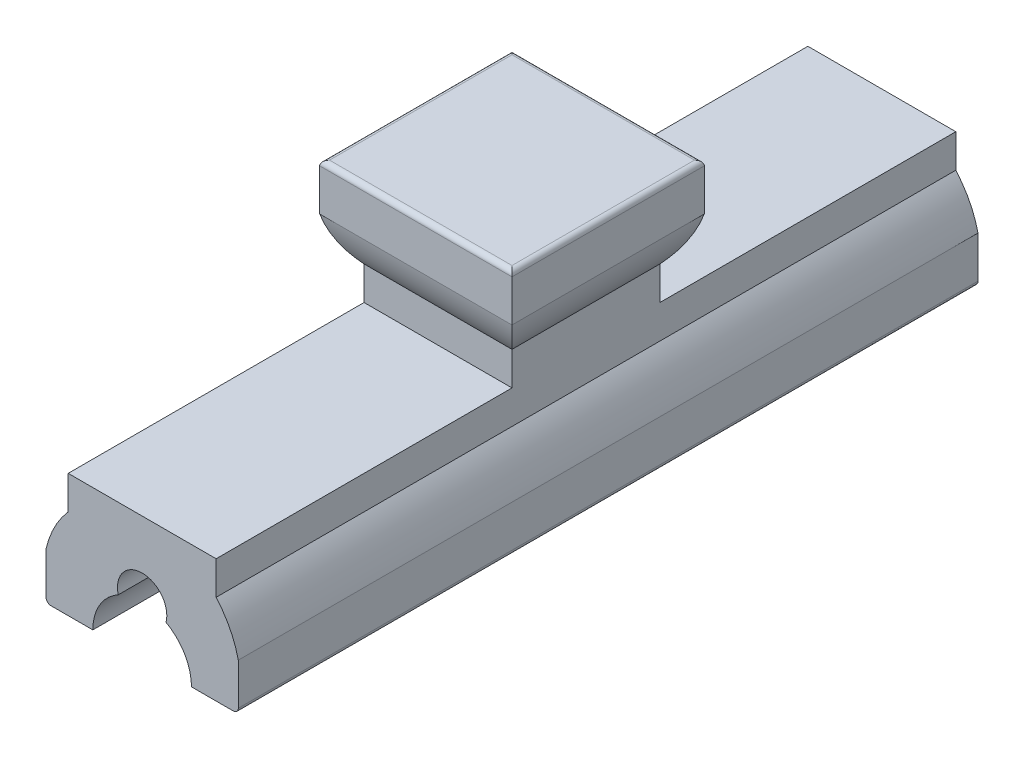
from build123d import *

# Parameters (mm, degrees)
EXTRUDE_2_DEPTH                 = 7.5
EXTRUDE_2_DEPTH_BACK            = 7.5
SKETCH_3_W                      = 3
SKETCH_3_H                      = 3
EXTRUDE_3_DEPTH                 = 1
EXTRUDE_4_DEPTH                 = 2
EXTRUDE_4_DEPTH_BACK            = 2
CUT_EXTRUDE_1_REACH             = 10.143
CUT_EXTRUDE_1_DIRECTION_2_REACH = 10.143
FILLET_1_R                      = 0.1


with BuildPart() as part:
    # 草图2 → 凸台-拉伸2 (new, two sides: drawn at the far end of the back side and taken through both)
    with BuildSketch(Plane.XY.offset(-EXTRUDE_2_DEPTH_BACK)):
        with BuildLine():
            Line((-1.95, -2.5), (-1, -2.5))
            ThreePointArc((-1, -2.5), (-0.861429892, -1.992123498), (-0.484122918, -1.625))
            ThreePointArc((-0.484122918, -1.625), (0, -1), (0.484122918, -1.625))
            ThreePointArc((0.484122918, -1.625), (0.861429892, -1.992123498), (1, -2.5))
            Line((1, -2.5), (1.95, -2.5))
            Line((1.95, -2.5), (1.95, -1.555590279))
            ThreePointArc((1.95, -1.555590279), (1.780042303, -1.088161527), (1.5, -0.677124344))
            Line((1.5, -0.677124344), (1.5, 0))
            Line((1.5, 0), (-1.5, 0))
            Line((-1.5, 0), (-1.5, -0.677124344))
            ThreePointArc((-1.5, -0.677124344), (-1.780042303, -1.088161527), (-1.95, -1.555590279))
            Line((-1.95, -1.555590279), (-1.95, -2.5))
        make_face()
    extrude(amount=EXTRUDE_2_DEPTH + EXTRUDE_2_DEPTH_BACK)

    # 草图3 → 凸台-拉伸3 (add)
    with BuildSketch(Plane(origin=(0, 0, 0), x_dir=(-1, 0, 0), z_dir=(0, 1, 0))):
        Rectangle(SKETCH_3_W, SKETCH_3_H)
    extrude(amount=EXTRUDE_3_DEPTH)

    # 草图4 → 凸台-拉伸4 (add, two sides: drawn at the far end of the back side and taken through both)
    with BuildSketch(Plane.XY.offset(-EXTRUDE_4_DEPTH_BACK)):
        with BuildLine():
            Line((1.95, 2.5), (-1.95, 2.5))
            Line((-1.95, 2.5), (-1.95, 1.555590279))
            ThreePointArc((-1.95, 1.555590279), (-1.780042303, 1.088161527), (-1.5, 0.677124344))
            Line((-1.5, 0.677124344), (1.5, 0.677124344))
            ThreePointArc((1.5, 0.677124344), (1.780042303, 1.088161527), (1.95, 1.555590279))
            Line((1.95, 1.555590279), (1.95, 2.5))
        make_face()
    extrude(amount=EXTRUDE_4_DEPTH + EXTRUDE_4_DEPTH_BACK)

    # 草图5 → 切除-拉伸1 (cut, up to next)
    with BuildSketch(Plane(origin=(0, 0, 0), x_dir=(0, 0, -1), z_dir=(1, 0, 0)), mode=Mode.PRIVATE) as cut_extrude_1_sk1:
        with BuildLine():
            Line((1.95, 2.5), (2, 2.5))
            Line((2, 2.5), (2, 0.677124344))
            Line((2, 0.677124344), (1.5, 0.677124344))
            ThreePointArc((1.5, 0.677124344), (1.780042303, 1.088161527), (1.95, 1.555590279))
            Line((1.95, 1.555590279), (1.95, 2.5))
        make_face()
    cut_extrude_1_tool1 = extrude(cut_extrude_1_sk1.sketch, amount=-CUT_EXTRUDE_1_REACH, mode=Mode.PRIVATE) & part.part
    # 草图5 → 切除-拉伸1 (cut, up to next)
    with BuildSketch(Plane(origin=(0, 0, 0), x_dir=(0, 0, -1), z_dir=(1, 0, 0)), mode=Mode.PRIVATE) as cut_extrude_1_sk2:
        with BuildLine():
            Line((-1.95, 2.5), (-1.95, 1.555590279))
            ThreePointArc((-1.95, 1.555590279), (-1.780042303, 1.088161527), (-1.5, 0.677124344))
            Line((-1.5, 0.677124344), (-2, 0.677124344))
            Line((-2, 0.677124344), (-2, 2.5))
            Line((-2, 2.5), (-1.95, 2.5))
        make_face()
    cut_extrude_1_tool2 = extrude(cut_extrude_1_sk2.sketch, amount=-CUT_EXTRUDE_1_REACH, mode=Mode.PRIVATE) & part.part
    add(cut_extrude_1_tool1.solids().sort_by_distance((0, 1.175075, -1.873038))[0], mode=Mode.SUBTRACT)
    add(cut_extrude_1_tool2.solids().sort_by_distance((0, 1.175075, 1.873038))[0], mode=Mode.SUBTRACT)

    # 草图5 → 切除-拉伸1 direction 2 (cut, up to next)
    with BuildSketch(Plane(origin=(0, 0, 0), x_dir=(0, 0, -1), z_dir=(1, 0, 0)), mode=Mode.PRIVATE) as cut_extrude_1_direction_2_sk1:
        with BuildLine():
            Line((1.95, 2.5), (2, 2.5))
            Line((2, 2.5), (2, 0.677124344))
            Line((2, 0.677124344), (1.5, 0.677124344))
            ThreePointArc((1.5, 0.677124344), (1.780042303, 1.088161527), (1.95, 1.555590279))
            Line((1.95, 1.555590279), (1.95, 2.5))
        make_face()
    cut_extrude_1_direction_2_tool1 = extrude(cut_extrude_1_direction_2_sk1.sketch, amount=CUT_EXTRUDE_1_DIRECTION_2_REACH, mode=Mode.PRIVATE) & part.part
    # 草图5 → 切除-拉伸1 direction 2 (cut, up to next)
    with BuildSketch(Plane(origin=(0, 0, 0), x_dir=(0, 0, -1), z_dir=(1, 0, 0)), mode=Mode.PRIVATE) as cut_extrude_1_direction_2_sk2:
        with BuildLine():
            Line((-1.95, 2.5), (-1.95, 1.555590279))
            ThreePointArc((-1.95, 1.555590279), (-1.780042303, 1.088161527), (-1.5, 0.677124344))
            Line((-1.5, 0.677124344), (-2, 0.677124344))
            Line((-2, 0.677124344), (-2, 2.5))
            Line((-2, 2.5), (-1.95, 2.5))
        make_face()
    cut_extrude_1_direction_2_tool2 = extrude(cut_extrude_1_direction_2_sk2.sketch, amount=CUT_EXTRUDE_1_DIRECTION_2_REACH, mode=Mode.PRIVATE) & part.part
    add(cut_extrude_1_direction_2_tool1.solids().sort_by_distance((0, 1.175075, -1.873038))[0], mode=Mode.SUBTRACT)
    add(cut_extrude_1_direction_2_tool2.solids().sort_by_distance((0, 1.175075, 1.873038))[0], mode=Mode.SUBTRACT)

    # 圆角1
    fillet_1_edges = [part.edges().sort_by_distance(p)[0] for p in [
        (-1.95, 2.5, 0),
        (0, 2.5, -1.95),
        (1.95, 2.5, 0),
        (0, 2.5, 1.95),
        (-1.95, -2.5, 0),
        (1.95, -2.5, 0),
    ]]
    fillet(fillet_1_edges, radius=FILLET_1_R)


solid = part.part
